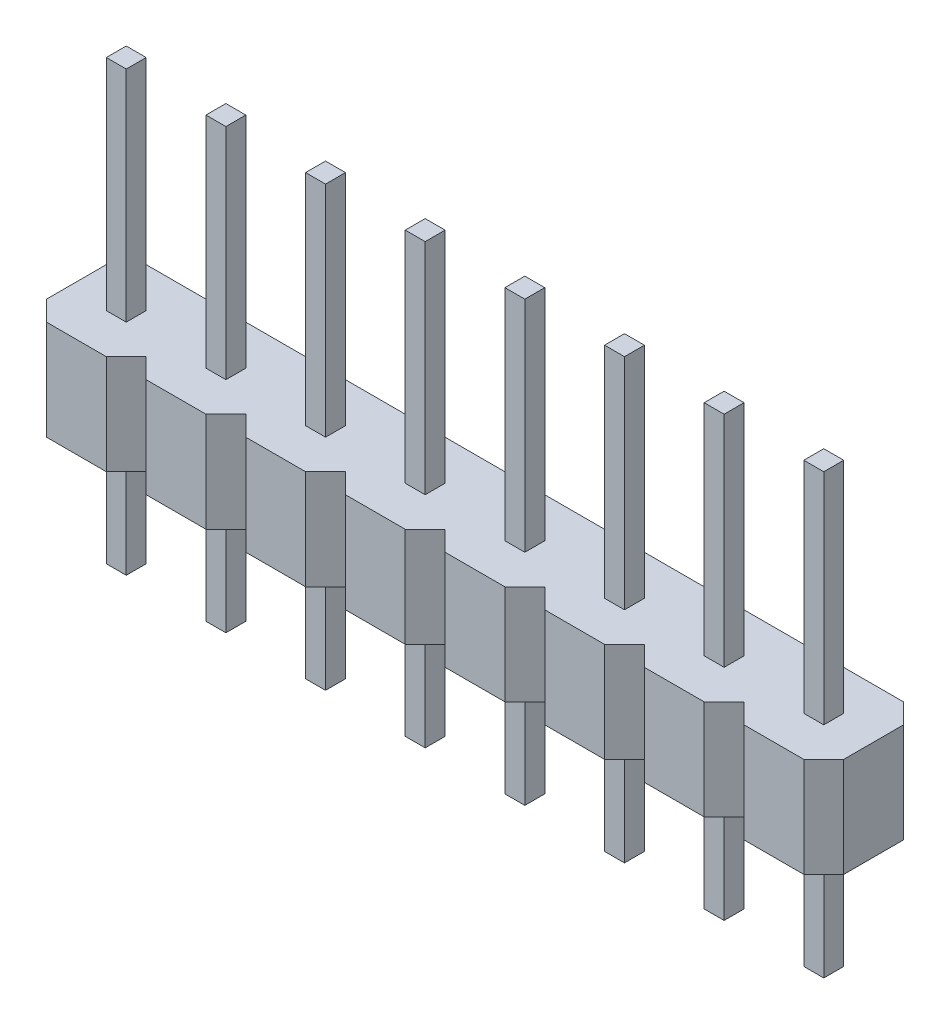
from build123d import *

# Parameters (mm, degrees)
BOSS_EXTRUDE1_DEPTH = 2.5
SKETCH2_W           = 0.5
SKETCH2_H           = 0.5
BOSS_EXTRUDE2_DEPTH = 5.5
SKETCH2_2_W         = 0.5
SKETCH2_2_H         = 0.5
BOSS_EXTRUDE3_DEPTH = 5.5


with BuildPart() as part:
    # Sketch1 → Boss-Extrude1 (new body)
    with BuildSketch(Plane(origin=(0, 0, 0), x_dir=(1, 0, 0), z_dir=(0, 1, 0))):
        Polygon((-1.25, 0.75), (-0.75, 1.25), (0.75, 1.25), (1.25, 0.75), (1.75, 1.25), (3.25, 1.25), (3.75, 0.75), (4.25, 1.25), (5.75, 1.25), (6.25, 0.75), (6.75, 1.25), (8.25, 1.25), (8.75, 0.75), (9.25, 1.25), (10.75, 1.25), (11.25, 0.75), (11.75, 1.25), (13.25, 1.25), (13.75, 0.75), (14.25, 1.25), (15.75, 1.25), (16.25, 0.75), (16.75, 1.25), (18.25, 1.25), (18.75, 0.75), (18.75, -0.75), (18.25, -1.25), (16.75, -1.25), (16.25, -0.75), (15.75, -1.25), (14.25, -1.25), (13.75, -0.75), (13.25, -1.25), (11.75, -1.25), (11.25, -0.75), (10.75, -1.25), (9.25, -1.25), (8.75, -0.75), (8.25, -1.25), (6.75, -1.25), (6.25, -0.75), (5.75, -1.25), (4.25, -1.25), (3.75, -0.75), (3.25, -1.25), (1.75, -1.25), (1.25, -0.75), (0.75, -1.25), (-0.75, -1.25), (-1.25, -0.75), align=None)
    extrude(amount=BOSS_EXTRUDE1_DEPTH)

    # Sketch2 → Boss-Extrude2 (add)
    with BuildSketch(Plane(origin=(0, 2.5, 0), x_dir=(1, 0, 0), z_dir=(0, 1, 0))):
        with Locations((2.5, 0)):
            Rectangle(SKETCH2_W, SKETCH2_H)
        Rectangle(SKETCH2_W, SKETCH2_H)
        with Locations((5, 0)):
            Rectangle(SKETCH2_W, SKETCH2_H)
        with Locations((7.5, 0)):
            Rectangle(SKETCH2_W, SKETCH2_H)
        with Locations((10, 0)):
            Rectangle(SKETCH2_W, SKETCH2_H)
        with Locations((12.5, 0)):
            Rectangle(SKETCH2_W, SKETCH2_H)
        with Locations((15, 0)):
            Rectangle(SKETCH2_W, SKETCH2_H)
        with Locations((17.5, 0)):
            Rectangle(SKETCH2_W, SKETCH2_H)
    extrude(amount=BOSS_EXTRUDE2_DEPTH)

    # Sketch2<2> → Boss-Extrude3 (add)
    with BuildSketch(Plane(origin=(0, 2.5, 0), x_dir=(1, 0, 0), z_dir=(0, 1, 0))):
        with Locations((2.5, 0)):
            Rectangle(SKETCH2_2_W, SKETCH2_2_H)
        Rectangle(SKETCH2_2_W, SKETCH2_2_H)
        with Locations((5, 0)):
            Rectangle(SKETCH2_2_W, SKETCH2_2_H)
        with Locations((7.5, 0)):
            Rectangle(SKETCH2_2_W, SKETCH2_2_H)
        with Locations((10, 0)):
            Rectangle(SKETCH2_2_W, SKETCH2_2_H)
        with Locations((12.5, 0)):
            Rectangle(SKETCH2_2_W, SKETCH2_2_H)
        with Locations((15, 0)):
            Rectangle(SKETCH2_2_W, SKETCH2_2_H)
        with Locations((17.5, 0)):
            Rectangle(SKETCH2_2_W, SKETCH2_2_H)
    extrude(amount=-BOSS_EXTRUDE3_DEPTH)


solid = part.part
